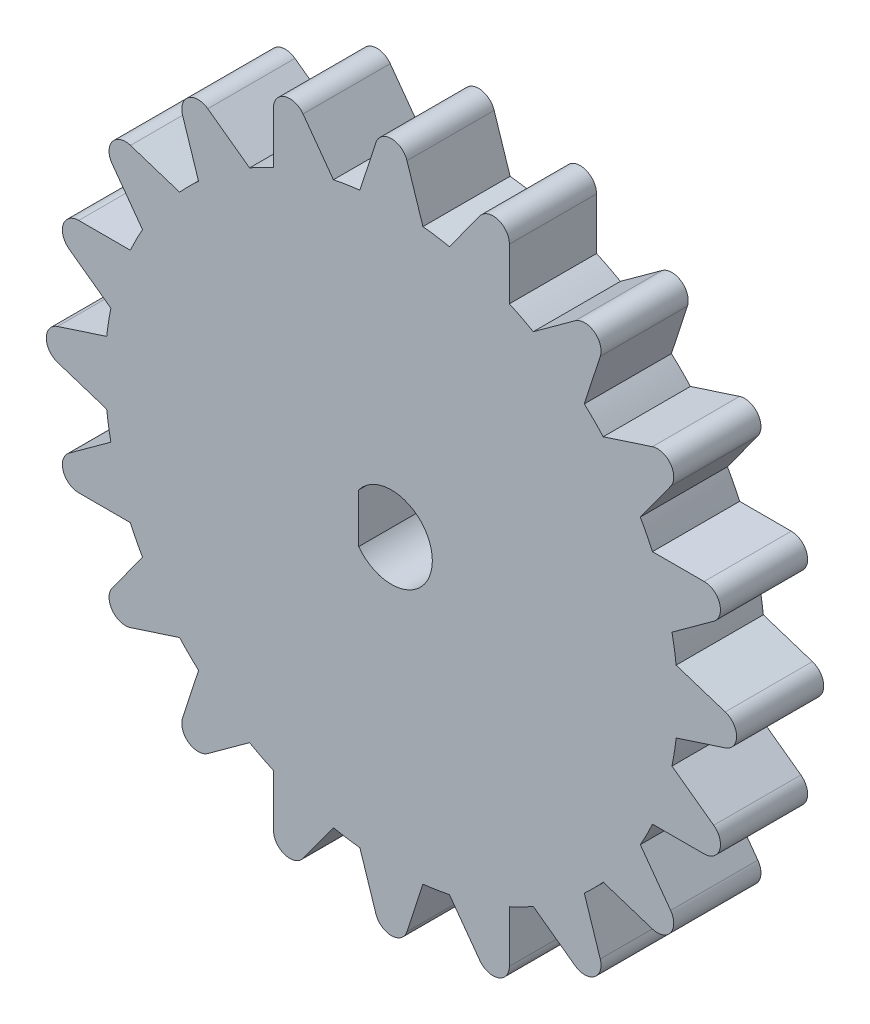
from build123d import *

# Parameters (mm, degrees)
DODANIE_WYCI_GNI_CIE1_DEPTH = 5.325088567


with BuildPart() as part:
    # Szkic1 → Dodanie-wyciągnięcie1 (new body)
    with BuildSketch(Plane.XY):
        with BuildLine():
            Line((-0.951045555, 20.39370068), (-1.925922284, 17.39370068))
            ThreePointArc((-1.925922284, 17.39370068), (-2.737603138, 17.28454596), (-3.543288168, 17.13753509))
            Line((-3.543288168, 17.13753509), (-5.397502016, 19.689451162))
            ThreePointArc((-5.397502016, 19.689451162), (-6.515515156, 20.052693732), (-7.206498161, 19.101672684))
            Line((-7.206498161, 19.101672684), (-7.206610043, 15.947249659))
            ThreePointArc((-7.206610043, 15.947249659), (-7.944833745, 15.592614173), (-8.665656885, 15.203828161))
            Line((-8.665656885, 15.203828161), (-11.217704483, 17.05786098))
            ThreePointArc((-11.217704483, 17.05786098), (-12.393246293, 17.057840133), (-12.756528516, 15.939839877))
            Line((-12.756528516, 15.939839877), (-11.7818646, 12.93977073))
            ThreePointArc((-11.7818646, 12.93977073), (-12.374368671, 12.374368671), (-12.93977073, 11.7818646))
            Line((-12.93977073, 11.7818646), (-15.939839877, 12.756528516))
            ThreePointArc((-15.939839877, 12.756528516), (-17.057840133, 12.393246293), (-17.05786098, 11.217704483))
            Line((-17.05786098, 11.217704483), (-15.203828161, 8.665656885))
            ThreePointArc((-15.203828161, 8.665656885), (-15.592614173, 7.944833745), (-15.947249659, 7.206610043))
            Line((-15.947249659, 7.206610043), (-19.101672684, 7.206498161))
            ThreePointArc((-19.101672684, 7.206498161), (-20.052693732, 6.515515156), (-19.689451162, 5.397502016))
            Line((-19.689451162, 5.397502016), (-17.13753509, 3.543288168))
            ThreePointArc((-17.13753509, 3.543288168), (-17.28454596, 2.737603138), (-17.39370068, 1.925922284))
            Line((-17.39370068, 1.925922284), (-20.39370068, 0.951045555))
            ThreePointArc((-20.39370068, 0.951045555), (-21.084649954, 0), (-20.39370068, -0.951045555))
            Line((-20.39370068, -0.951045555), (-17.39370068, -1.925922284))
            ThreePointArc((-17.39370068, -1.925922284), (-17.28454596, -2.737603138), (-17.13753509, -3.543288168))
            Line((-17.13753509, -3.543288168), (-19.689451162, -5.397502016))
            ThreePointArc((-19.689451162, -5.397502016), (-20.052693732, -6.515515156), (-19.101672684, -7.206498161))
            Line((-19.101672684, -7.206498161), (-15.947249659, -7.206610043))
            ThreePointArc((-15.947249659, -7.206610043), (-15.592614173, -7.944833745), (-15.203828161, -8.665656885))
            Line((-15.203828161, -8.665656885), (-17.05786098, -11.217704483))
            ThreePointArc((-17.05786098, -11.217704483), (-17.057840133, -12.393246293), (-15.939839877, -12.756528516))
            Line((-15.939839877, -12.756528516), (-12.93977073, -11.7818646))
            ThreePointArc((-12.93977073, -11.7818646), (-12.374368671, -12.374368671), (-11.7818646, -12.93977073))
            Line((-11.7818646, -12.93977073), (-12.756528516, -15.939839877))
            ThreePointArc((-12.756528516, -15.939839877), (-12.393246293, -17.057840133), (-11.217704483, -17.05786098))
            Line((-11.217704483, -17.05786098), (-8.665656885, -15.203828161))
            ThreePointArc((-8.665656885, -15.203828161), (-7.944833745, -15.592614173), (-7.206610043, -15.947249659))
            Line((-7.206610043, -15.947249659), (-7.206498161, -19.101672684))
            ThreePointArc((-7.206498161, -19.101672684), (-6.515515156, -20.052693732), (-5.397502016, -19.689451162))
            Line((-5.397502016, -19.689451162), (-3.543288168, -17.13753509))
            ThreePointArc((-3.543288168, -17.13753509), (-2.737603138, -17.28454596), (-1.925922284, -17.39370068))
            Line((-1.925922284, -17.39370068), (-0.951045555, -20.39370068))
            ThreePointArc((-0.951045555, -20.39370068), (0, -21.084649954), (0.951045555, -20.39370068))
            Line((0.951045555, -20.39370068), (1.925922284, -17.39370068))
            ThreePointArc((1.925922284, -17.39370068), (2.737603138, -17.28454596), (3.543288168, -17.13753509))
            Line((3.543288168, -17.13753509), (5.397502016, -19.689451162))
            ThreePointArc((5.397502016, -19.689451162), (6.515515156, -20.052693732), (7.206498161, -19.101672684))
            Line((7.206498161, -19.101672684), (7.206610043, -15.947249659))
            ThreePointArc((7.206610043, -15.947249659), (7.944833745, -15.592614173), (8.665656885, -15.203828161))
            Line((8.665656885, -15.203828161), (11.217704483, -17.05786098))
            ThreePointArc((11.217704483, -17.05786098), (12.393246293, -17.057840133), (12.756528516, -15.939839877))
            Line((12.756528516, -15.939839877), (11.7818646, -12.93977073))
            ThreePointArc((11.7818646, -12.93977073), (12.374368671, -12.374368671), (12.93977073, -11.7818646))
            Line((12.93977073, -11.7818646), (15.939839877, -12.756528516))
            ThreePointArc((15.939839877, -12.756528516), (17.057840133, -12.393246293), (17.05786098, -11.217704483))
            Line((17.05786098, -11.217704483), (15.203828161, -8.665656885))
            ThreePointArc((15.203828161, -8.665656885), (15.592614173, -7.944833745), (15.947249659, -7.206610043))
            Line((15.947249659, -7.206610043), (19.101672684, -7.206498161))
            ThreePointArc((19.101672684, -7.206498161), (20.052693732, -6.515515156), (19.689451162, -5.397502016))
            Line((19.689451162, -5.397502016), (17.13753509, -3.543288168))
            ThreePointArc((17.13753509, -3.543288168), (17.28454596, -2.737603138), (17.39370068, -1.925922284))
            Line((17.39370068, -1.925922284), (20.39370068, -0.951045555))
            ThreePointArc((20.39370068, -0.951045555), (21.084649954, 0), (20.39370068, 0.951045555))
            Line((20.39370068, 0.951045555), (17.39370068, 1.925922284))
            ThreePointArc((17.39370068, 1.925922284), (17.28454596, 2.737603138), (17.13753509, 3.543288168))
            Line((17.13753509, 3.543288168), (19.689451162, 5.397502016))
            ThreePointArc((19.689451162, 5.397502016), (20.052693732, 6.515515156), (19.101672684, 7.206498161))
            Line((19.101672684, 7.206498161), (15.947249659, 7.206610043))
            ThreePointArc((15.947249659, 7.206610043), (15.592614173, 7.944833745), (15.203828161, 8.665656885))
            Line((15.203828161, 8.665656885), (17.05786098, 11.217704483))
            ThreePointArc((17.05786098, 11.217704483), (17.057840133, 12.393246293), (15.939839877, 12.756528516))
            Line((15.939839877, 12.756528516), (12.93977073, 11.7818646))
            ThreePointArc((12.93977073, 11.7818646), (12.374368671, 12.374368671), (11.7818646, 12.93977073))
            Line((11.7818646, 12.93977073), (12.756528516, 15.939839877))
            ThreePointArc((12.756528516, 15.939839877), (12.393246293, 17.057840133), (11.217704483, 17.05786098))
            Line((11.217704483, 17.05786098), (8.665656885, 15.203828161))
            ThreePointArc((8.665656885, 15.203828161), (7.944833745, 15.592614173), (7.206610043, 15.947249659))
            Line((7.206610043, 15.947249659), (7.206498161, 19.101672684))
            ThreePointArc((7.206498161, 19.101672684), (6.515515156, 20.052693732), (5.397502016, 19.689451162))
            Line((5.397502016, 19.689451162), (3.543288168, 17.13753509))
            ThreePointArc((3.543288168, 17.13753509), (2.737603138, 17.28454596), (1.925922284, 17.39370068))
            Line((1.925922284, 17.39370068), (0.951045555, 20.39370068))
            ThreePointArc((0.951045555, 20.39370068), (0, 21.084649954), (-0.951045555, 20.39370068))
        make_face()
        with BuildLine():
            Line((-2, 1.5), (-2, -1.5))
            ThreePointArc((-2, -1.5), (2.5, 0), (-2, 1.5))
        make_face(mode=Mode.SUBTRACT)
    extrude(amount=DODANIE_WYCI_GNI_CIE1_DEPTH)


solid = part.part
